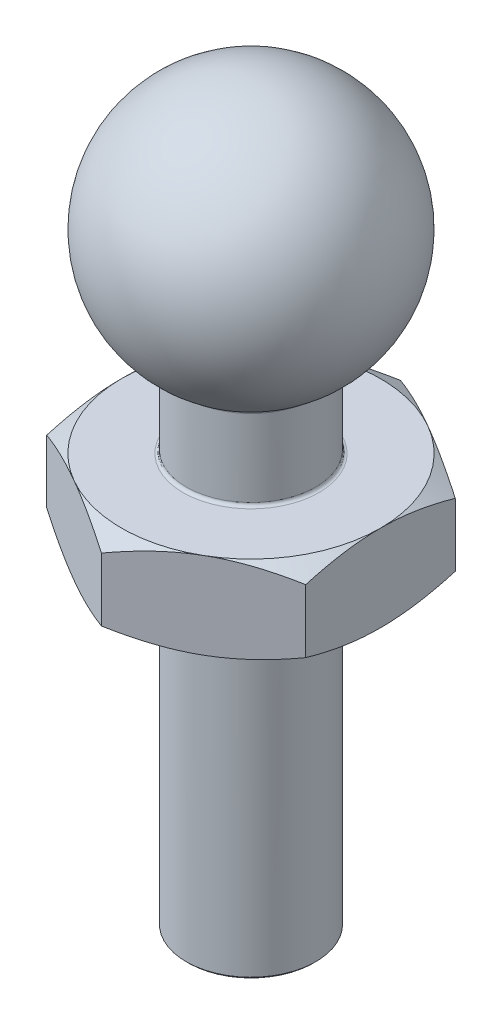
from build123d import *

# Parameters (mm, degrees)
CHAMFER17_SIZE      = 0.05
BOSS_EXTRUDE2_DEPTH = 2
SKETCH5_OUTSIDE_W   = 18.79
SKETCH5_OUTSIDE_H   = 19.718
SKETCH5_OUTSIDE_R   = 3
CUT_EXTRUDE1_DEPTH  = 2
CUT_EXTRUDE1_DRAFT  = -60
SKETCH6_OUTSIDE_W   = 18.79
SKETCH6_OUTSIDE_H   = 19.718
SKETCH6_OUTSIDE_R   = 3
CUT_EXTRUDE2_DEPTH  = 2
CUT_EXTRUDE2_DRAFT  = -60
FILLET2_R           = 0.075


with BuildPart() as part:
    # Sketch1 → Revolve1 (revolve)
    with BuildSketch(Plane.XY):
        with BuildLine():
            Line((0, 11), (0, 17))
            ThreePointArc((0, 17), (2.897777479, 14.776457135), (1.5, 11.401923789))
            Line((1.5, 11.401923789), (1.5, 0))
            Line((1.5, 0), (0, 0))
            Line((0, 0), (0, 11))
        make_face()
    revolve(axis=Axis((0, 11, 0), (0, -1, 0)))

    # Chamfer17
    chamfer17_edges = [part.edges().sort_by_distance(p)[0] for p in [
        (-1.5, 0, 0),
    ]]
    chamfer(chamfer17_edges, length=CHAMFER17_SIZE)

    # Sketch4 → Boss-Extrude2 (add)
    with BuildSketch(Plane(origin=(0, 7.5, 0), x_dir=(1, 0, 0), z_dir=(0, 1, 0))):
        Polygon((0, 3.464101615), (-3, 1.732050808), (-3, -1.732050808), (0, -3.464101615), (3, -1.732050808), (3, 1.732050808), align=None)
    extrude(amount=BOSS_EXTRUDE2_DEPTH)


with BuildPart() as cut_extrude1_tool:
    # Sketch5 outside → Cut-Extrude1 (with draft: the straight prism first)
    with BuildSketch(Plane.XZ.offset(-7.5)):
        Rectangle(SKETCH5_OUTSIDE_W, SKETCH5_OUTSIDE_H)
        Circle(SKETCH5_OUTSIDE_R, mode=Mode.SUBTRACT)
    extrude(amount=-CUT_EXTRUDE1_DEPTH)
    # Cut-Extrude1: the draft: its side faces are tilted about the plane it starts from
    cut_extrude1_sides = [cut_extrude1_tool.faces().sort_by_distance(p)[0] for p in [
        (0, 8.5, -9.859),
        (9.395, 8.5, 0),
        (0, 8.5, 9.859),
        (-9.395, 8.5, 0),
        (-3, 8.5, 0),
    ]]
    draft(cut_extrude1_sides, Plane.XZ.offset(-7.5), CUT_EXTRUDE1_DRAFT)


with BuildPart() as part_1:
    add(part.part)

    # Cut-Extrude1: cut by cut_extrude1_tool
    add(cut_extrude1_tool.part, mode=Mode.SUBTRACT)


with BuildPart() as cut_extrude2_tool:
    # Sketch6 outside → Cut-Extrude2 (with draft: the straight prism first)
    with BuildSketch(Plane(origin=(0, 9.5, 0), x_dir=(1, 0, 0), z_dir=(0, 1, 0))):
        Rectangle(SKETCH6_OUTSIDE_W, SKETCH6_OUTSIDE_H)
        Circle(SKETCH6_OUTSIDE_R, mode=Mode.SUBTRACT)
    extrude(amount=-CUT_EXTRUDE2_DEPTH)
    # Cut-Extrude2: the draft: its side faces are tilted about the plane it starts from
    cut_extrude2_sides = [cut_extrude2_tool.faces().sort_by_distance(p)[0] for p in [
        (0, 8.5, 9.859),
        (9.395, 8.5, 0),
        (0, 8.5, -9.859),
        (-9.395, 8.5, 0),
        (-3, 8.5, 0),
    ]]
    draft(cut_extrude2_sides, Plane(origin=(0, 9.5, 0), x_dir=(1, 0, 0), z_dir=(0, 1, 0)), CUT_EXTRUDE2_DRAFT)


with BuildPart() as part_2:
    add(part_1.part)

    # Cut-Extrude2: cut by cut_extrude2_tool
    add(cut_extrude2_tool.part, mode=Mode.SUBTRACT)

    # Fillet2
    fillet2_edges = [part_2.edges().sort_by_distance(p)[0] for p in [
        (-1.5, 9.5, 0),
        (-1.5, 11.401923789, 0),
    ]]
    fillet(fillet2_edges, radius=FILLET2_R)


solid = part_2.part
